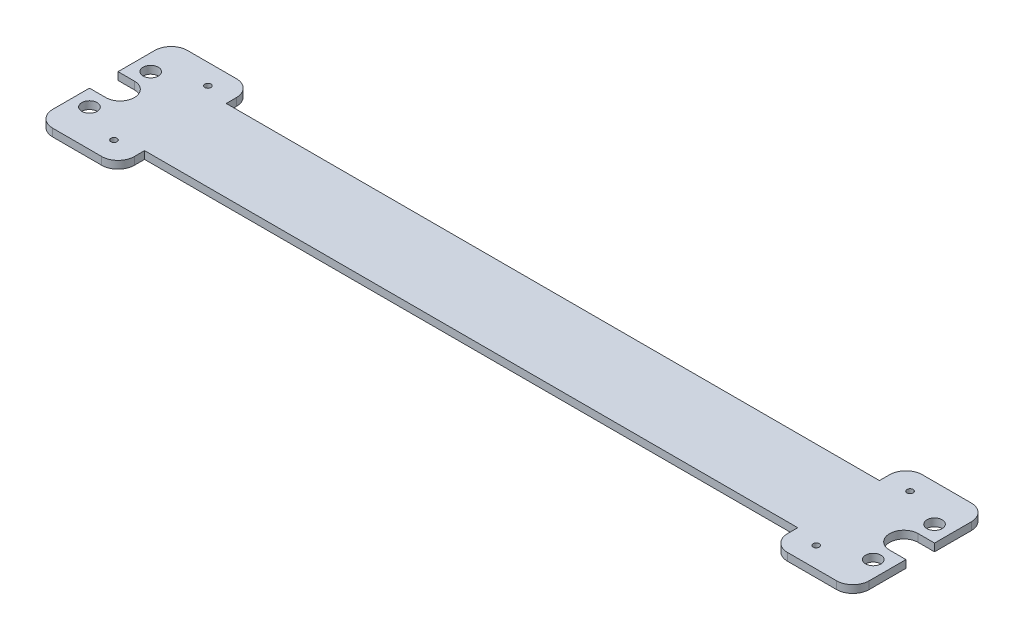
from build123d import *

# Parameters (mm, degrees)
SKETCH1_R           = 4.7625
SKETCH1_R_2         = 1.905
BOSS_EXTRUDE1_DEPTH = 4.7625


with BuildPart() as part:
    # Sketch1 → Boss-Extrude1 (new body)
    with BuildSketch(Plane(origin=(0, 0, 0), x_dir=(1, 0, 0), z_dir=(0, 1, 0))):
        with BuildLine():
            Line((10.16, 0), (40.64, 0))
            ThreePointArc((40.64, 0), (47.824204897, -2.975795103), (50.8, -10.16))
            Line((50.8, -10.16), (50.8, -16.51))
            Line((50.8, -16.51), (254, -16.51))
            Line((254, -16.51), (254, -67.31))
            Line((254, -67.31), (50.8, -67.31))
            Line((50.8, -67.31), (50.8, -73.66))
            ThreePointArc((50.8, -73.66), (47.824204897, -80.844204897), (40.64, -83.82))
            Line((40.64, -83.82), (10.16, -83.82))
            ThreePointArc((10.16, -83.82), (2.975795103, -80.844204897), (0, -73.66))
            Line((0, -73.66), (0, -50.8))
            Line((0, -50.8), (10.16, -50.8))
            ThreePointArc((10.16, -50.8), (19.05, -41.91), (10.16, -33.02))
            Line((10.16, -33.02), (0, -33.02))
            Line((0, -33.02), (0, -10.16))
            ThreePointArc((0, -10.16), (2.975795103, -2.975795103), (10.16, 0))
        make_face()
        with Locations(Location((10.16, -60.96, 0), (0, 0, 90))):
            Circle(SKETCH1_R, mode=Mode.SUBTRACT)
        with Locations(Location((10.16, -22.86, 0), (0, 0, 90))):
            Circle(SKETCH1_R, mode=Mode.SUBTRACT)
        with Locations(Location((35.56, -71.12, 0), (0, 0, 90))):
            Circle(SKETCH1_R_2, mode=Mode.SUBTRACT)
        with Locations(Location((35.56, -12.7, 0), (0, 0, 90))):
            Circle(SKETCH1_R_2, mode=Mode.SUBTRACT)
    boss_extrude1 = extrude(amount=BOSS_EXTRUDE1_DEPTH)

    # Mirror1: Boss-Extrude1 across plane
    add(boss_extrude1.mirror(Plane(origin=(254, 4.7625, 67.31), x_dir=(0, 0, 1), z_dir=(-1, 0, 0))))


solid = part.part
